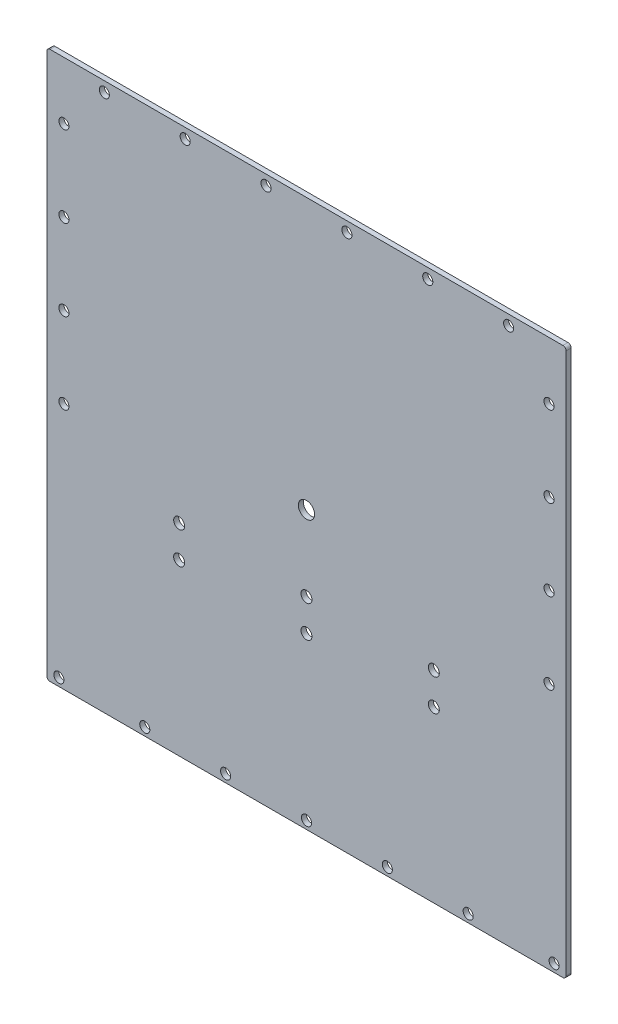
from build123d import *

# Parameters (mm, degrees)
SKETCH2_W               = 163.1
SKETCH2_H               = 171.98
SKETCH2_R               = 2.5527
SKETCH2_R_2             = 1.5875
BOSS_EXTRUDE2_DEPTH     = 1.5875
FILLET1_R               = 1
CUT_EXTRUDE1_DEPTH      = 238.715061694
CUT_EXTRUDE1_DEPTH_BACK = 238.715061694
SKETCH3_R               = 1.725


with BuildPart() as part:
    # Sketch2 → Boss-Extrude2 (new body)
    with BuildSketch(Plane.XY):
        with Locations((82.55, -85.99)):
            Rectangle(SKETCH2_W, SKETCH2_H)
        with Locations((82.55, -85)):
            Circle(SKETCH2_R, mode=Mode.SUBTRACT)
        with Locations((82.55, -169.48)):
            Circle(SKETCH2_R_2, mode=Mode.SUBTRACT)
        with Locations((4.7625, -169.48)):
            Circle(SKETCH2_R_2, mode=Mode.SUBTRACT)
        with Locations((31.75, -169.48)):
            Circle(SKETCH2_R_2, mode=Mode.SUBTRACT)
        with Locations((57.15, -169.48)):
            Circle(SKETCH2_R_2, mode=Mode.SUBTRACT)
        with Locations((6.35, -94.25)):
            Circle(SKETCH2_R_2, mode=Mode.SUBTRACT)
        with Locations((6.35, -68.85)):
            Circle(SKETCH2_R_2, mode=Mode.SUBTRACT)
        with Locations((6.35, -43.45)):
            Circle(SKETCH2_R_2, mode=Mode.SUBTRACT)
        with Locations((6.35, -18.05)):
            Circle(SKETCH2_R_2, mode=Mode.SUBTRACT)
        with Locations((19.05, -3.175)):
            Circle(SKETCH2_R_2, mode=Mode.SUBTRACT)
        with Locations((44.45, -3.175)):
            Circle(SKETCH2_R_2, mode=Mode.SUBTRACT)
        with Locations((69.85, -3.175)):
            Circle(SKETCH2_R_2, mode=Mode.SUBTRACT)
        with Locations((158.75, -43.45)):
            Circle(SKETCH2_R_2, mode=Mode.SUBTRACT)
        with Locations((158.75, -18.05)):
            Circle(SKETCH2_R_2, mode=Mode.SUBTRACT)
        with Locations((146.05, -3.175)):
            Circle(SKETCH2_R_2, mode=Mode.SUBTRACT)
        with Locations((107.95, -169.48)):
            Circle(SKETCH2_R_2, mode=Mode.SUBTRACT)
        with Locations((133.35, -169.48)):
            Circle(SKETCH2_R_2, mode=Mode.SUBTRACT)
        with Locations((160.3375, -169.48)):
            Circle(SKETCH2_R_2, mode=Mode.SUBTRACT)
        with Locations((158.75, -94.25)):
            Circle(SKETCH2_R_2, mode=Mode.SUBTRACT)
        with Locations((158.75, -68.85)):
            Circle(SKETCH2_R_2, mode=Mode.SUBTRACT)
        with Locations((95.25, -3.175)):
            Circle(SKETCH2_R_2, mode=Mode.SUBTRACT)
        with Locations((120.65, -3.175)):
            Circle(SKETCH2_R_2, mode=Mode.SUBTRACT)
    extrude(amount=BOSS_EXTRUDE2_DEPTH)

    # Fillet1
    fillet1_edges = [part.edges().sort_by_distance(p)[0] for p in [
        (1, -171.98, 0.79375),
        (1, 0, 0.79375),
        (164.1, 0, 0.79375),
        (164.1, -171.98, 0.79375),
    ]]
    fillet(fillet1_edges, radius=FILLET1_R)

    # Sketch3 → Cut-Extrude1 (cut, two sides: drawn at the far end of the back side and taken through both)
    with BuildSketch(Plane.XY.offset(1.5875).offset(-CUT_EXTRUDE1_DEPTH_BACK)):
        with Locations((42.55, -108.63038)):
            Circle(SKETCH3_R)
        with Locations((82.55, -108.63038)):
            Circle(SKETCH3_R)
        with Locations((122.55, -108.63038)):
            Circle(SKETCH3_R)
        with Locations((42.55, -118.63038)):
            Circle(SKETCH3_R)
        with Locations((82.55, -118.63038)):
            Circle(SKETCH3_R)
        with Locations((122.55, -118.63038)):
            Circle(SKETCH3_R)
    extrude(amount=CUT_EXTRUDE1_DEPTH + CUT_EXTRUDE1_DEPTH_BACK, mode=Mode.SUBTRACT)


solid = part.part
